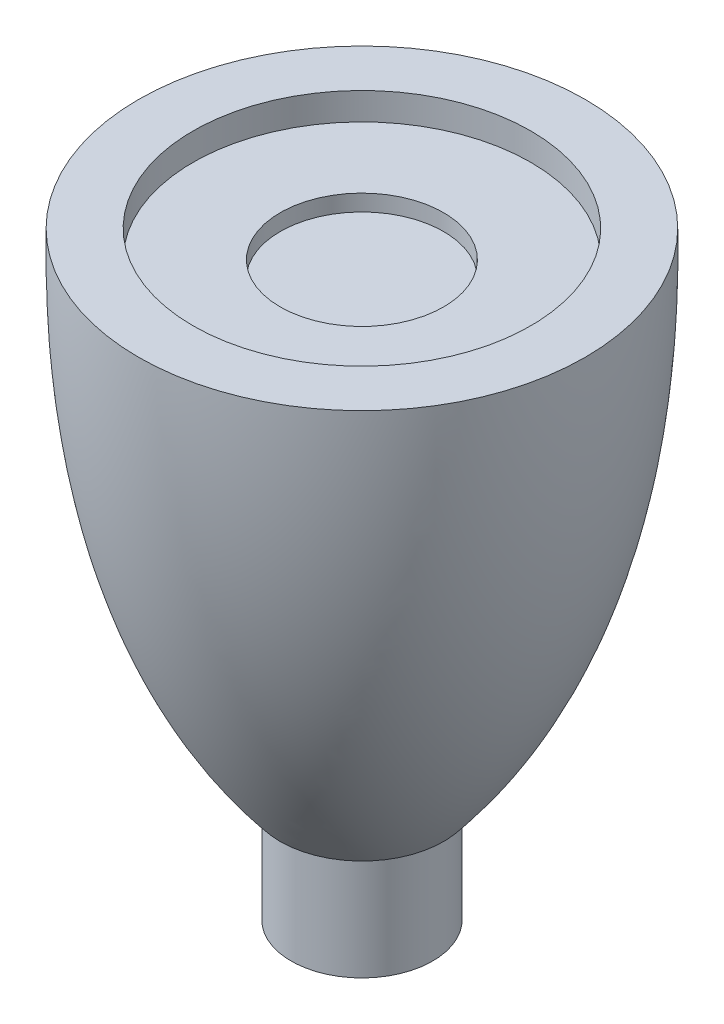
from build123d import *

# Parameters (mm, degrees)
SKETCH2_R           = 15.5
CUT_EXTRUDE1_DEPTH  = 2.5
SKETCH3_R           = 7.5
CUT_EXTRUDE2_DEPTH  = 4
SKETCH4_R           = 6.5
BOSS_EXTRUDE1_DEPTH = 10


with BuildPart() as part:
    # Sketch1 → Revolve1 (revolve)
    with BuildSketch(Plane.XY):
        with BuildLine():
            Line((0, 45), (0, 0))
            Line((0, 0), (-7.5, 0))
            add(Edge.make_bspline(
                [(-20.5, 45), (-20.945482832, 16.446098589), (-7.5, 0)],
                knots=[0, 0, 0, 0.557031676, 0.557031676, 0.557031676], degree=2))
            Line((-20.5, 45), (0, 45))
        make_face()
    revolve(axis=Axis((0, 45, 0), (0, -1, 0)))

    # Sketch2 → Cut-Extrude1 (cut)
    with BuildSketch(Plane(origin=(0, 45, 0), x_dir=(1, 0, 0), z_dir=(0, 1, 0))):
        with Locations(Location((0, 0, 0), (0, 0, 270))):
            Circle(SKETCH2_R)
    extrude(amount=-CUT_EXTRUDE1_DEPTH, mode=Mode.SUBTRACT)

    # Sketch3 → Cut-Extrude2 (cut)
    with BuildSketch(Plane(origin=(0, 45, 0), x_dir=(1, 0, 0), z_dir=(0, 1, 0))):
        with Locations(Location((0, 0, 0), (0, 0, 270))):
            Circle(SKETCH3_R)
    extrude(amount=-CUT_EXTRUDE2_DEPTH, mode=Mode.SUBTRACT)

    # Sketch4 → Boss-Extrude1 (add)
    with BuildSketch(Plane.XZ):
        with Locations(Location((0, 0, 0), (0, 0, 270))):
            Circle(SKETCH4_R)
    extrude(amount=BOSS_EXTRUDE1_DEPTH)

    # Sketch6 → Cut-Revolve1 (revolve, cut)
    with BuildSketch(Plane.XY):
        with BuildLine():
            Line((0, 36), (0, 0))
            Line((0, 0), (0, -10))
            Line((0, -10), (-2.5, -10))
            Line((-2.5, -10), (-2.5, 0))
            add(Edge.make_bspline(
                [(-15.275259687, 36), (-14.25878691, 21.174216867), (-10.000367015, 9.174216867), (-2.5, 0)],
                knots=[0.09093365, 0.09093365, 0.09093365, 0.09093365, 0.557031676, 0.557031676, 0.557031676, 0.557031676], degree=3))
            Line((-15.275259687, 36), (0, 36))
        make_face()
    revolve(axis=Axis((0, 36, 0), (0, -1, 0)), mode=Mode.SUBTRACT)


solid = part.part
